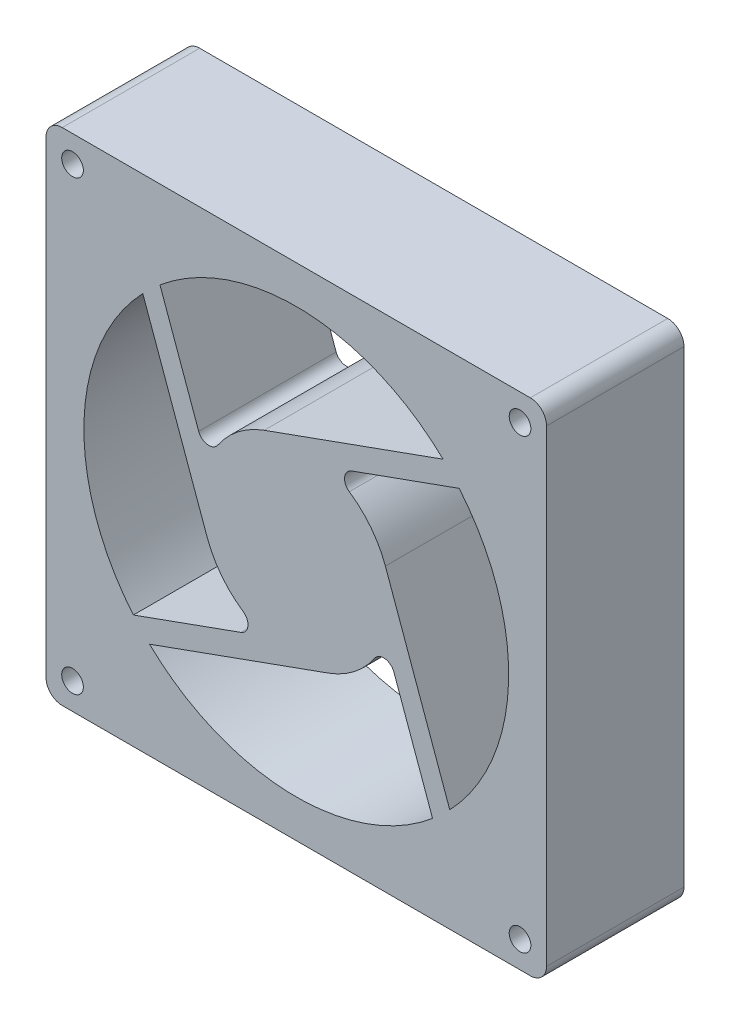
from build123d import *

# Parameters (mm, degrees)
SKETCH_1_W      = 92.5
SKETCH_1_H      = 92.5
SKETCH_1_R      = 2
EXTRUDE_1_DEPTH = 25.4
FILLET_2_R      = 3


with BuildPart() as part:
    # Эскиз1 → Бобышка-Вытянуть1 (new body)
    with BuildSketch(Plane.XY):
        Rectangle(SKETCH_1_W, SKETCH_1_H)
        with Locations((-41.35, 41.35)):
            Circle(SKETCH_1_R, mode=Mode.SUBTRACT)
        with Locations((-41.35, -41.35)):
            Circle(SKETCH_1_R, mode=Mode.SUBTRACT)
        with Locations((41.35, -41.35)):
            Circle(SKETCH_1_R, mode=Mode.SUBTRACT)
        with Locations((41.35, 41.35)):
            Circle(SKETCH_1_R, mode=Mode.SUBTRACT)
        with BuildLine():
            Line((30.103737124, 25.18585935), (10.244232434, 18.036233028))
            ThreePointArc((10.244232434, 18.036233028), (8.93715954, 16.402747815), (9.801515353, 14.497596242))
            ThreePointArc((9.801515353, 14.497596242), (13.81482208, 10.742471359), (16.465475636, 5.92774089))
            Line((16.465475636, 5.92774089), (28.365935027, -27.128144611))
            ThreePointArc((28.365935027, -27.128144611), (39.228362099, -1.303114362), (30.103737124, 25.18585935))
        make_face(mode=Mode.SUBTRACT)
        with BuildLine():
            Line((5.92774089, -16.465475636), (-27.128144611, -28.365935027))
            ThreePointArc((-27.128144611, -28.365935027), (-1.303114362, -39.228362099), (25.18585935, -30.103737124))
            Line((25.18585935, -30.103737124), (18.036233028, -10.244232434))
            ThreePointArc((18.036233028, -10.244232434), (16.402747815, -8.93715954), (14.497596242, -9.801515353))
            ThreePointArc((14.497596242, -9.801515353), (10.742471359, -13.81482208), (5.92774089, -16.465475636))
        make_face(mode=Mode.SUBTRACT)
        with BuildLine():
            Line((-16.465475636, -5.92774089), (-28.365935027, 27.128144611))
            ThreePointArc((-28.365935027, 27.128144611), (-39.228362099, 1.303114362), (-30.103737124, -25.18585935))
            Line((-30.103737124, -25.18585935), (-10.244232434, -18.036233028))
            ThreePointArc((-10.244232434, -18.036233028), (-8.93715954, -16.402747815), (-9.801515353, -14.497596242))
            ThreePointArc((-9.801515353, -14.497596242), (-13.81482208, -10.742471359), (-16.465475636, -5.92774089))
        make_face(mode=Mode.SUBTRACT)
        with BuildLine():
            Line((-5.92774089, 16.465475636), (27.128144611, 28.365935027))
            ThreePointArc((27.128144611, 28.365935027), (1.303114362, 39.228362099), (-25.18585935, 30.103737124))
            Line((-25.18585935, 30.103737124), (-18.036233028, 10.244232434))
            ThreePointArc((-18.036233028, 10.244232434), (-16.402747815, 8.93715954), (-14.497596242, 9.801515353))
            ThreePointArc((-14.497596242, 9.801515353), (-10.742471359, 13.81482208), (-5.92774089, 16.465475636))
        make_face(mode=Mode.SUBTRACT)
    extrude(amount=EXTRUDE_1_DEPTH)

    # Скругление2
    fillet_2_edges = [part.edges().sort_by_distance(p)[0] for p in [
        (-46.25, 46.25, 12.7),
        (46.25, 46.25, 12.7),
        (46.25, -46.25, 12.7),
        (-46.25, -46.25, 12.7),
    ]]
    fillet(fillet_2_edges, radius=FILLET_2_R)


solid = part.part
